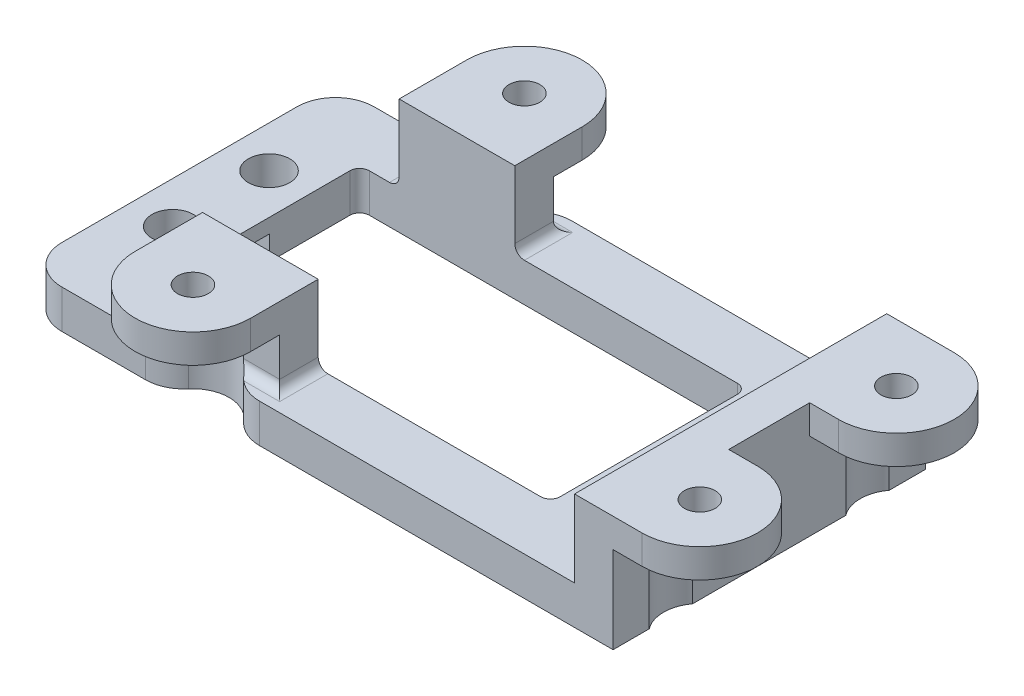
from build123d import *

# Parameters (mm, degrees)
SKETCH1_W           = 57.2
SKETCH1_H           = 32.4
SKETCH1_W_2         = 40.2
SKETCH1_H_2         = 20.4
BOSS_EXTRUDE1_DEPTH = 4
FILLET1_R           = 1
SKETCH2_R           = 2.15
CUT_EXTRUDE1_DEPTH  = 34.111931384
CUT_EXTRUDE2_DEPTH  = 0.85
SKETCH5_W           = 12
SKETCH5_H           = 4
BOSS_EXTRUDE2_DEPTH = 8
SKETCH6_R           = 1.6
BOSS_EXTRUDE3_DEPTH = 3
CUT_EXTRUDE3_REACH  = 40.732
SKETCH7_R           = 3.75
FILLET4_R           = 4
FILLET6_R           = 1
SKETCH8_W           = 4
SKETCH8_H           = 32.4
BOSS_EXTRUDE4_DEPTH = 12
SKETCH9_R           = 1.6
BOSS_EXTRUDE6_DEPTH = 3
SKETCH10_R          = 3.75
CUT_EXTRUDE4_DEPTH  = 9


with BuildPart() as part:
    # Sketch1 → Boss-Extrude1 (new body)
    with BuildSketch(Plane(origin=(0, 0, 0), x_dir=(1, 0, 0), z_dir=(0, 1, 0))):
        Rectangle(SKETCH1_W, SKETCH1_H)
        Rectangle(SKETCH1_W_2, SKETCH1_H_2, mode=Mode.SUBTRACT)
    extrude(amount=BOSS_EXTRUDE1_DEPTH)

    # Fillet1
    fillet1_edges = [part.edges().sort_by_distance(p)[0] for p in [
        (-20.1, 2, -10.2),
        (-20.1, 2, 10.2),
        (20.1, 2, 10.2),
        (20.1, 2, -10.2),
    ]]
    fillet(fillet1_edges, radius=FILLET1_R)

    # Sketch2 → Cut-Extrude1 (cut, through all)
    with BuildSketch(Plane(origin=(0, 4, 0), x_dir=(1, 0, 0), z_dir=(0, 1, 0))):
        with Locations(Location((-24.3, 5, 0), (0, 0, 270))):
            Circle(SKETCH2_R)
        with Locations(Location((-24.3, -5, 0), (0, 0, 270))):
            Circle(SKETCH2_R)
        with Locations(Location((24.3, -5, 0), (0, 0, 270))):
            Circle(SKETCH2_R)
        with Locations(Location((24.3, 5, 0), (0, 0, 270))):
            Circle(SKETCH2_R)
    extrude(amount=-CUT_EXTRUDE1_DEPTH, mode=Mode.SUBTRACT)

    # Sketch3 → Cut-Extrude2 (cut, symmetric)
    with BuildSketch(Plane.XY):
        Polygon((-26.5, 0), (-26.5, 0.7), (-21.2, 2.5), (-20.1, 2.5), (-20.1, 0), align=None)
    cut_extrude2 = extrude(amount=CUT_EXTRUDE2_DEPTH, both=True, mode=Mode.SUBTRACT)

    # Mirror1: Cut-Extrude2 across plane
    add(cut_extrude2.mirror(Plane(origin=(0, 0, 0), x_dir=(0, 0, 1), z_dir=(1, 0, 0))), mode=Mode.SUBTRACT)

    # Sketch5 → Boss-Extrude2 (add)
    with BuildSketch(Plane(origin=(0, 4, 0), x_dir=(1, 0, 0), z_dir=(0, 1, 0))):
        with Locations((-10, -12.2)):
            Rectangle(SKETCH5_W, SKETCH5_H)
    boss_extrude2 = extrude(amount=BOSS_EXTRUDE2_DEPTH)

    # Sketch6 → Boss-Extrude3 (add)
    with BuildSketch(Plane(origin=(0, 12, 0), x_dir=(1, 0, 0), z_dir=(0, 1, 0))):
        with BuildLine():
            Line((-16, -14.2), (-4, -14.2))
            Line((-4, -14.2), (-4, -17.2))
            ThreePointArc((-4, -17.2), (-10, -23.2), (-16, -17.2))
            Line((-16, -17.2), (-16, -14.2))
        make_face()
        with Locations(Location((-10, -17.2, 0), (0, 0, 270))):
            Circle(SKETCH6_R, mode=Mode.SUBTRACT)
    boss_extrude3 = extrude(amount=-BOSS_EXTRUDE3_DEPTH)

    # Cut-Extrude3: up to this face of the body (flat: up to its plane)
    cut_extrude3_end = Plane(part.part.faces().sort_by_distance((-10, 9, 23.05))[0])
    # Sketch7 → Cut-Extrude3 (cut, up to the picked face)
    with BuildSketch(Plane.XZ, mode=Mode.PRIVATE) as cut_extrude3_sk1:
        with Locations((-10, 17.2)):
            Circle(SKETCH7_R)
    cut_extrude3_tool1 = split(extrude(cut_extrude3_sk1.sketch, amount=-CUT_EXTRUDE3_REACH, mode=Mode.PRIVATE), bisect_by=cut_extrude3_end, keep=Keep.BOTH, mode=Mode.PRIVATE)
    cut_extrude3 = cut_extrude3_tool1.solids().sort_by(Axis((-10, 0, 17.2), (0, 1, 0)))[0]
    add(cut_extrude3, mode=Mode.SUBTRACT)

    # Mirror4: Boss-Extrude2, Boss-Extrude3, Cut-Extrude3 across plane
    add(boss_extrude2.mirror(Plane.XY))
    add(boss_extrude3.mirror(Plane.XY))
    add(cut_extrude3.mirror(Plane.XY), mode=Mode.SUBTRACT)

    # Fillet4
    fillet4_edges = [part.edges().sort_by_distance(p)[0] for p in [
        (-6.385791926, 2, 16.2),
        (-13.614208074, 2, 16.2),
        (-6.385791926, 2, -16.2),
        (-13.614208074, 2, -16.2),
        (-28.6, 2, -16.2),
        (-28.6, 2, 16.2),
    ]]
    fillet(fillet4_edges, radius=FILLET4_R)

    # Fillet6
    fillet6_edges = [part.edges().sort_by_distance(p)[0] for p in [
        (-14.125, 4, 14.2),
        (-16, 4, 12.2),
        (-5.875, 4, -14.2),
        (-14.125, 4, -14.2),
        (-4, 4, -12.2),
        (-16, 4, -12.2),
        (-4, 4, 12.2),
        (-5.875, 4, 14.2),
    ]]
    fillet(fillet6_edges, radius=FILLET6_R)

    # Sketch8 → Boss-Extrude4 (add)
    with BuildSketch(Plane.XZ):
        with Locations((30.6, 0)):
            Rectangle(SKETCH8_W, SKETCH8_H)
    extrude(amount=-BOSS_EXTRUDE4_DEPTH)

    # Sketch9 → Boss-Extrude6 (add)
    with BuildSketch(Plane(origin=(0, 12, 0), x_dir=(1, 0, 0), z_dir=(0, 1, 0))):
        with BuildLine():
            Line((32.6, -16.2), (32.6, -4.2))
            Line((32.6, -4.2), (35.6, -4.2))
            ThreePointArc((35.6, -4.2), (41.6, -10.2), (35.6, -16.2))
            Line((35.6, -16.2), (32.6, -16.2))
        make_face()
        with Locations(Location((35.6, -10.2, 0), (0, 0, 270))):
            Circle(SKETCH9_R, mode=Mode.SUBTRACT)
    boss_extrude6 = extrude(amount=-BOSS_EXTRUDE6_DEPTH)

    # Sketch10 → Cut-Extrude4 (cut)
    with BuildSketch(Plane.XZ):
        with Locations((35.6, 10.2)):
            Circle(SKETCH10_R)
    cut_extrude4 = extrude(amount=-CUT_EXTRUDE4_DEPTH, mode=Mode.SUBTRACT)

    # Mirror5: Boss-Extrude6, Cut-Extrude4 across plane
    add(boss_extrude6.mirror(Plane.XY))
    add(cut_extrude4.mirror(Plane.XY), mode=Mode.SUBTRACT)


solid = part.part
